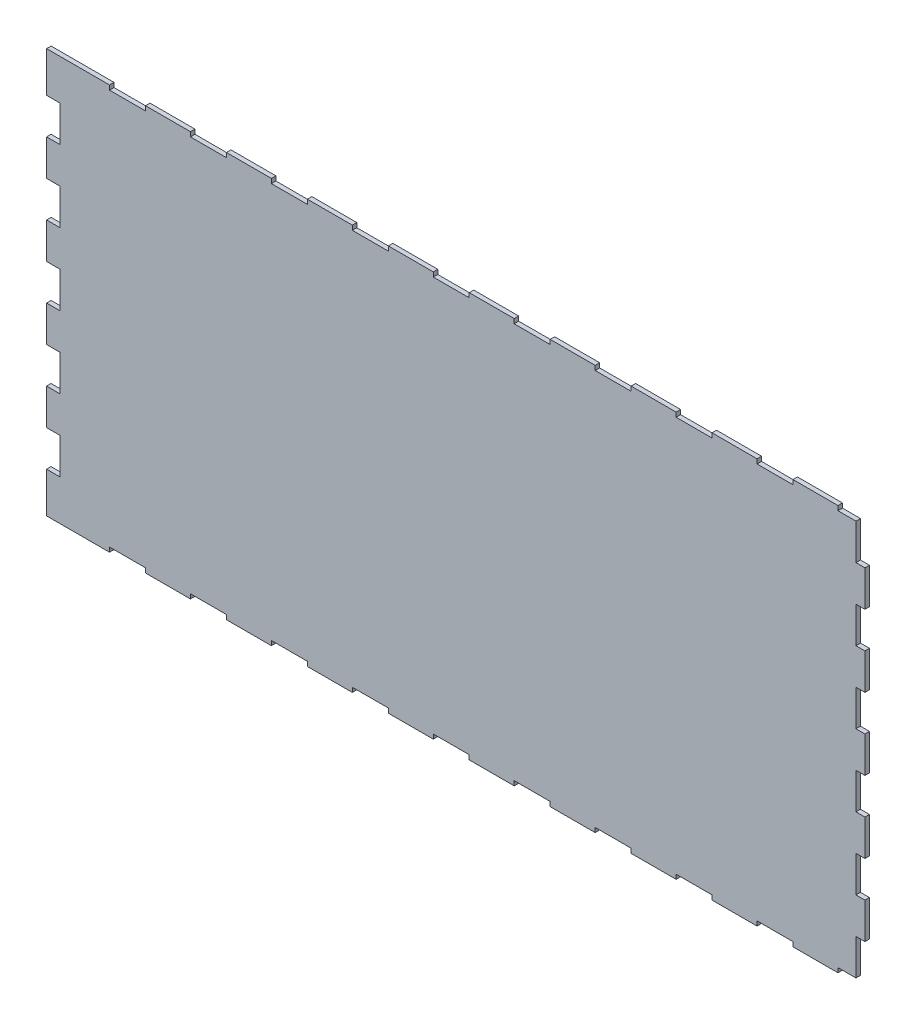
from build123d import *

# Parameters (mm, degrees)
BOSS_EXTRUDE1_DEPTH = 5


with BuildPart() as part:
    # Sketch1 → Boss-Extrude1 (new body)
    with BuildSketch(Plane.XY):
        Polygon((0, 180), (0, 220), (-20, 220), (-20, 225), (-70, 225), (-70, 220), (-110, 220), (-110, 225), (-160, 225), (-160, 220), (-200, 220), (-200, 225), (-250, 225), (-250, 220), (-290, 220), (-290, 225), (-340, 225), (-340, 220), (-380, 220), (-380, 225), (-430, 225), (-430, 220), (-470, 220), (-470, 225), (-520, 225), (-520, 220), (-560, 220), (-560, 225), (-610, 225), (-610, 220), (-650, 220), (-650, 225), (-700, 225), (-700, 220), (-740, 220), (-740, 225), (-790, 225), (-790, 220), (-830, 220), (-830, 225), (-900, 225), (-900, 180), (-885, 180), (-885, 140), (-900, 140), (-900, 100), (-885, 100), (-885, 60), (-900, 60), (-900, 20), (-885, 20), (-885, -20), (-900, -20), (-900, -60), (-885, -60), (-885, -100), (-900, -100), (-900, -140), (-885, -140), (-885, -180), (-900, -180), (-900, -225), (-830, -225), (-830, -220), (-790, -220), (-790, -225), (-740, -225), (-740, -220), (-700, -220), (-700, -225), (-650, -225), (-650, -220), (-610, -220), (-610, -225), (-560, -225), (-560, -220), (-520, -220), (-520, -225), (-470, -225), (-470, -220), (-430, -220), (-430, -225), (-380, -225), (-380, -220), (-340, -220), (-340, -225), (-290, -225), (-290, -220), (-250, -220), (-250, -225), (-200, -225), (-200, -220), (-160, -220), (-160, -225), (-110, -225), (-110, -220), (-70, -220), (-70, -225), (-20, -225), (-20, -220), (0, -220), (0, -180), (10, -180), (10, -140), (0, -140), (0, -100), (10, -100), (10, -60), (0, -60), (0, -20), (10, -20), (10, 20), (0, 20), (0, 60), (10, 60), (10, 100), (0, 100), (0, 140), (10, 140), (10, 180), align=None)
    extrude(amount=BOSS_EXTRUDE1_DEPTH)


solid = part.part
